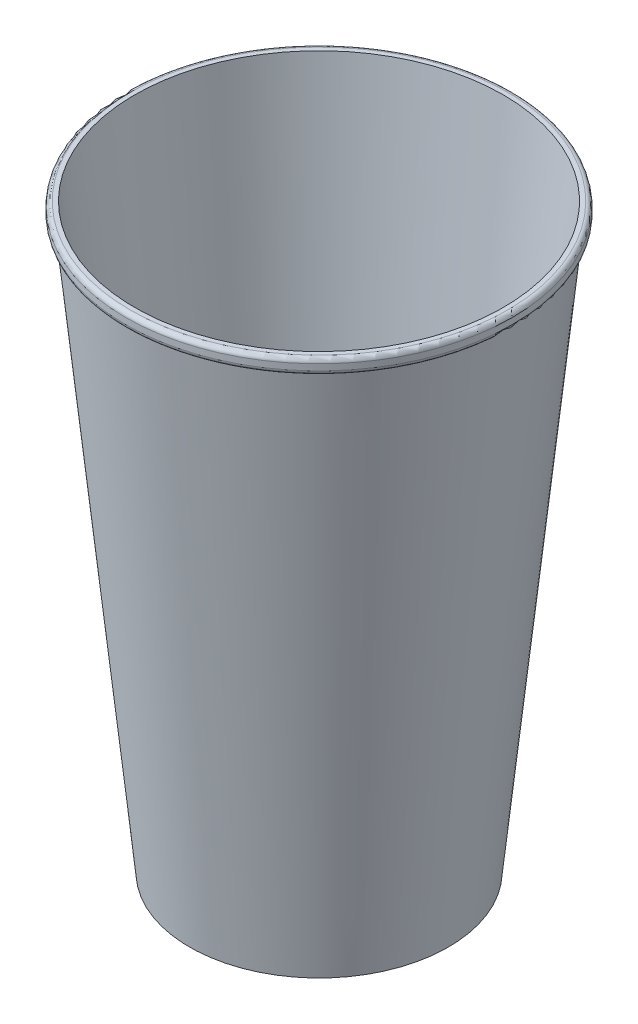
from build123d import *

# Parameters (mm, degrees)
REDONDEO1_R = 1


with BuildPart() as part:
    # Croquis1 → Revolución1 (revolve)
    with BuildSketch(Plane.XY, mode=Mode.PRIVATE) as revoluci_n1_sk:
        Polygon((29.505177058, 0), (42.658761964, 129.1), (44, 129.1), (44, 132.5), (42, 132.5), (29.264150943, 7.5), (0, 7.5), (0, 6.5), (29.162264151, 6.5), (28.5, 0), align=None)
    revolve(revoluci_n1_sk.sketch.rotate(Axis((0, 0, 0), (0, 1, 0)), 90), axis=Axis((0, 0, 0), (0, 1, 0)))

    # Redondeo1
    redondeo1_edges = [part.edges().sort_by_distance(p)[0] for p in [
        (0, 132.5, 44),
        (0, 129.1, 44),
    ]]
    fillet(redondeo1_edges, radius=REDONDEO1_R)


solid = part.part
